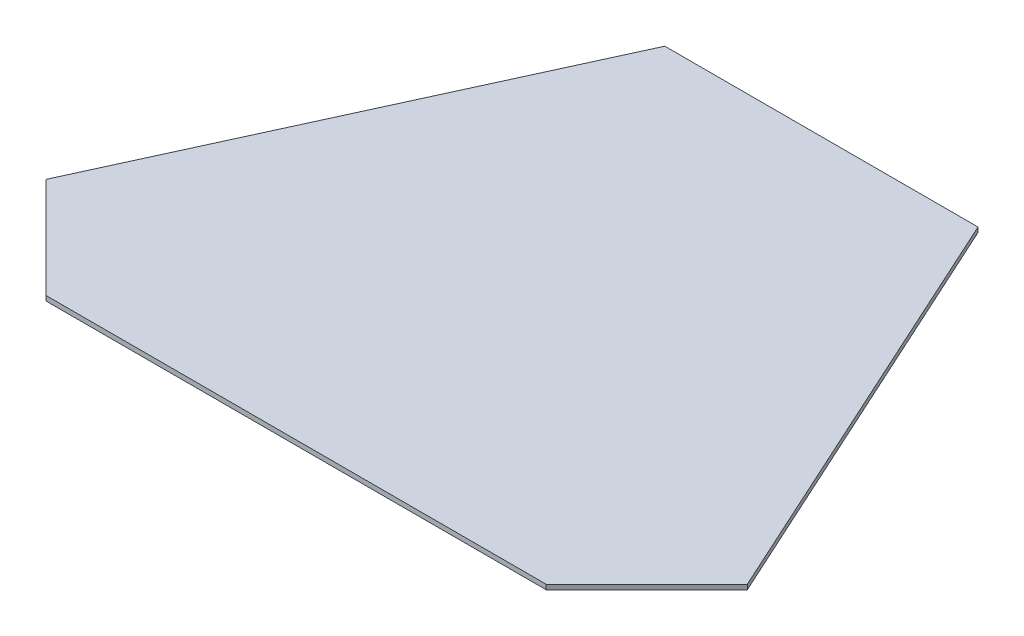
from build123d import *

# Parameters (mm, degrees)
SKETCH1_W           = 500
SKETCH1_H           = 500
BOSS_EXTRUDE1_DEPTH = 2.9972
SKETCH2_OUTSIDE_W   = 643.422
SKETCH2_OUTSIDE_H   = 643.422
CUT_EXTRUDE1_DEPTH  = 708.113133245


with BuildPart() as part:
    # Sketch1 → Boss-Extrude1 (new body)
    with BuildSketch(Plane(origin=(0, 0, 0), x_dir=(1, 0, 0), z_dir=(0, 1, 0))):
        with Locations((250, -250)):
            Rectangle(SKETCH1_W, SKETCH1_H)
    extrude(amount=BOSS_EXTRUDE1_DEPTH)

    # Sketch2 outside → Cut-Extrude1 (cut, through all)
    with BuildSketch(Plane(origin=(0, 2.9972, 0), x_dir=(1, 0, 0), z_dir=(0, 1, 0))):
        with Locations((250, -250)):
            Rectangle(SKETCH2_OUTSIDE_W, SKETCH2_OUTSIDE_H)
        Polygon((315.903157035, 0), (436.747635081, -264.516499207), (374.133645972, -327.130488316), (62.613989109, -327.130488316), (0, -264.516499207), (120.844478046, 0), align=None, mode=Mode.SUBTRACT)
    extrude(amount=-CUT_EXTRUDE1_DEPTH, mode=Mode.SUBTRACT)


solid = part.part
